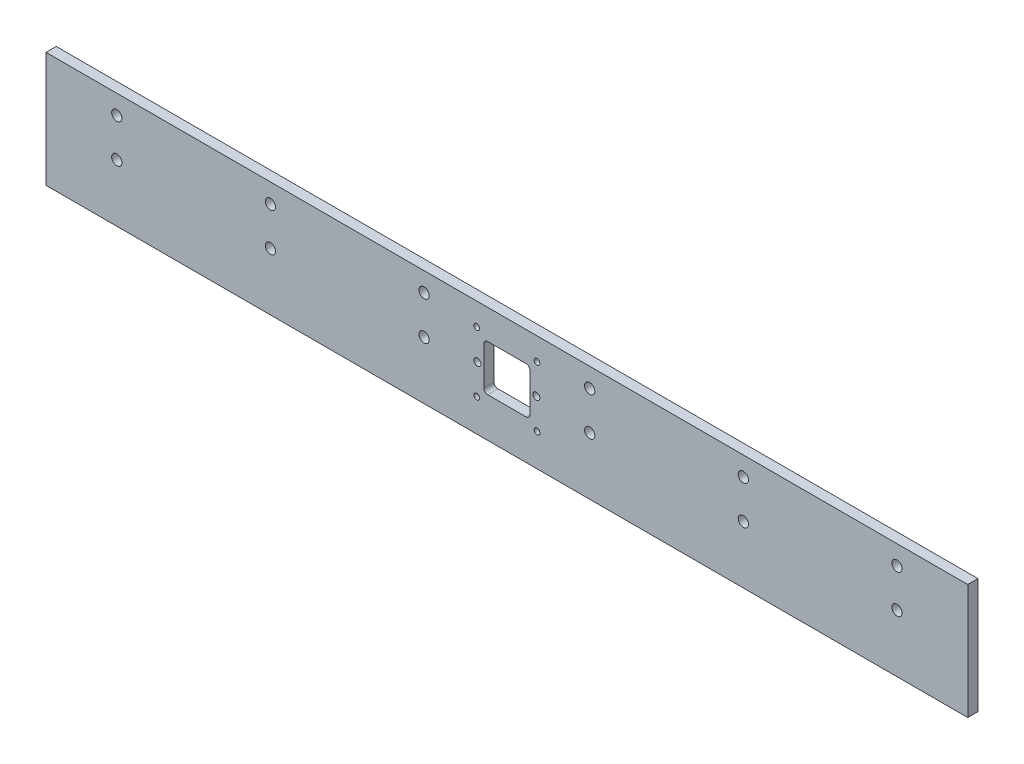
from build123d import *

# Parameters (mm, degrees)
ESQUISSE1_W        = 680
ESQUISSE1_H        = 90
ESQUISSE1_R        = 2.75
ESQUISSE1_R_2      = 2.25
ESQUISSE1_R_3      = 4
BOSS_EXTRU_1_DEPTH = 8
ESQUISSE2_W        = 8
ESQUISSE2_H        = 90
BOSS_EXTRU_2_DEPTH = 20
ESQUISSE3_W        = 8
ESQUISSE3_H        = 90
BOSS_EXTRU_3_DEPTH = 20


with BuildPart() as part:
    # Esquisse1 → Boss.-Extru.1 (new body)
    with BuildSketch(Plane.XY):
        with Locations((340, 45)):
            Rectangle(ESQUISSE1_W, ESQUISSE1_H)
        with Locations((317, 48.92)):
            Circle(ESQUISSE1_R, mode=Mode.SUBTRACT)
        with Locations((363, 48.92)):
            Circle(ESQUISSE1_R, mode=Mode.SUBTRACT)
        with Locations((316.45, 72.47)):
            Circle(ESQUISSE1_R_2, mode=Mode.SUBTRACT)
        with Locations((363.55, 72.47)):
            Circle(ESQUISSE1_R_2, mode=Mode.SUBTRACT)
        with Locations(Location((363.55, 25.37, 0), (0, 0, 180))):
            Circle(ESQUISSE1_R_2, mode=Mode.SUBTRACT)
        with Locations(Location((316.45, 25.37, 0), (0, 0, 180))):
            Circle(ESQUISSE1_R_2, mode=Mode.SUBTRACT)
        with Locations((35.3, 75)):
            Circle(ESQUISSE1_R_3, mode=Mode.SUBTRACT)
        with Locations((35.3, 45)):
            Circle(ESQUISSE1_R_3, mode=Mode.SUBTRACT)
        with Locations(Location((644.7, 45, 0), (0, 0, 180))):
            Circle(ESQUISSE1_R_3, mode=Mode.SUBTRACT)
        with Locations(Location((644.7, 75, 0), (0, 0, 180))):
            Circle(ESQUISSE1_R_3, mode=Mode.SUBTRACT)
        with Locations((155.3, 75)):
            Circle(ESQUISSE1_R_3, mode=Mode.SUBTRACT)
        with Locations((155.3, 45)):
            Circle(ESQUISSE1_R_3, mode=Mode.SUBTRACT)
        with Locations((275.3, 75)):
            Circle(ESQUISSE1_R_3, mode=Mode.SUBTRACT)
        with Locations((275.3, 45)):
            Circle(ESQUISSE1_R_3, mode=Mode.SUBTRACT)
        with Locations(Location((404.7, 45, 0), (0, 0, 180))):
            Circle(ESQUISSE1_R_3, mode=Mode.SUBTRACT)
        with Locations(Location((404.7, 75, 0), (0, 0, 180))):
            Circle(ESQUISSE1_R_3, mode=Mode.SUBTRACT)
        with Locations(Location((524.7, 75, 0), (0, 0, 180))):
            Circle(ESQUISSE1_R_3, mode=Mode.SUBTRACT)
        with Locations(Location((524.7, 45, 0), (0, 0, 180))):
            Circle(ESQUISSE1_R_3, mode=Mode.SUBTRACT)
        with BuildLine():
            Line((340, 30.92), (355, 30.92))
            ThreePointArc((355, 30.92), (357.121320344, 31.798679656), (358, 33.92))
            Line((358, 33.92), (358, 63.92))
            ThreePointArc((358, 63.92), (357.121320344, 66.041320344), (355, 66.92))
            Line((355, 66.92), (325, 66.92))
            ThreePointArc((325, 66.92), (322.878679656, 66.041320344), (322, 63.92))
            Line((322, 63.92), (322, 33.92))
            ThreePointArc((322, 33.92), (322.878679656, 31.798679656), (325, 30.92))
            Line((325, 30.92), (340, 30.92))
        make_face(mode=Mode.SUBTRACT)
    extrude(amount=BOSS_EXTRU_1_DEPTH)

    # Esquisse2 → Boss.-Extru.2 (add)
    with BuildSketch(Plane(origin=(680, 0, 0), x_dir=(0, 0, -1), z_dir=(1, 0, 0))):
        with Locations((-4, 45)):
            Rectangle(ESQUISSE2_W, ESQUISSE2_H)
    extrude(amount=BOSS_EXTRU_2_DEPTH)

    # Esquisse3 → Boss.-Extru.3 (add)
    with BuildSketch(Plane.ZY):
        with Locations((4, 45)):
            Rectangle(ESQUISSE3_W, ESQUISSE3_H)
    extrude(amount=BOSS_EXTRU_3_DEPTH)


solid = part.part
